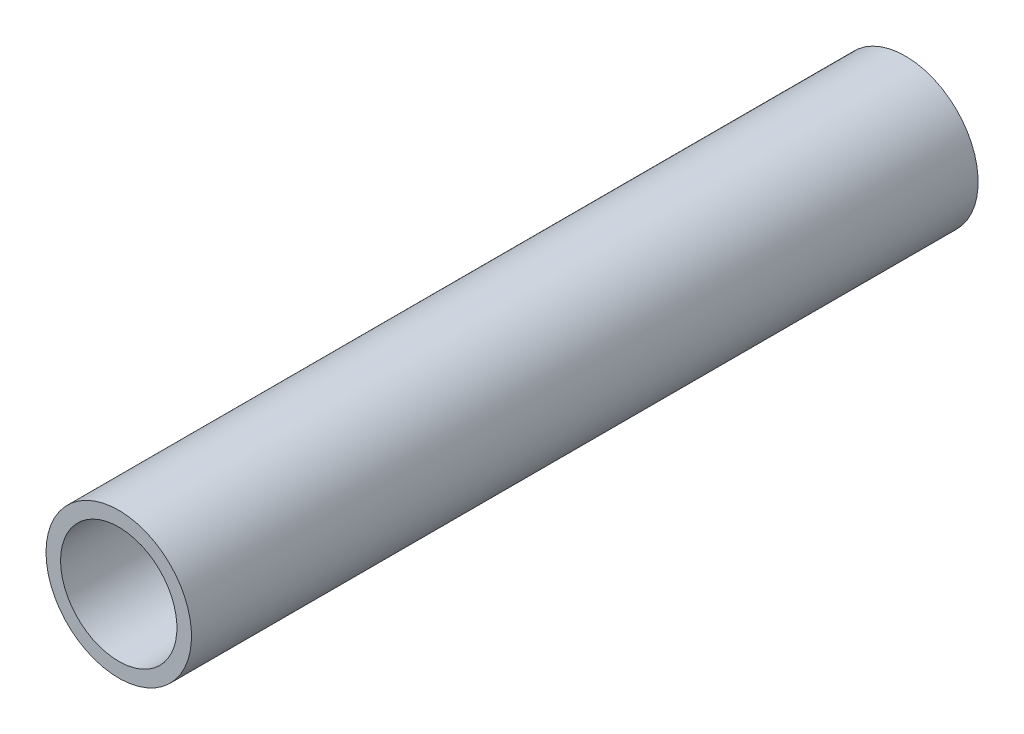
from build123d import *

# Parameters (mm, degrees)
SKETCH1_R           = 1.25
SKETCH1_R_2         = 1
BOSS_EXTRUDE1_DEPTH = 13.52


with BuildPart() as part:
    # Sketch1 → Boss-Extrude1 (new body)
    with BuildSketch(Plane.XY):
        with Locations(Location((0, 0, 0), (0, 0, 180))):
            Circle(SKETCH1_R)
        with Locations(Location((0, 0, 0), (0, 0, 180))):
            Circle(SKETCH1_R_2, mode=Mode.SUBTRACT)
    extrude(amount=BOSS_EXTRUDE1_DEPTH)


solid = part.part
